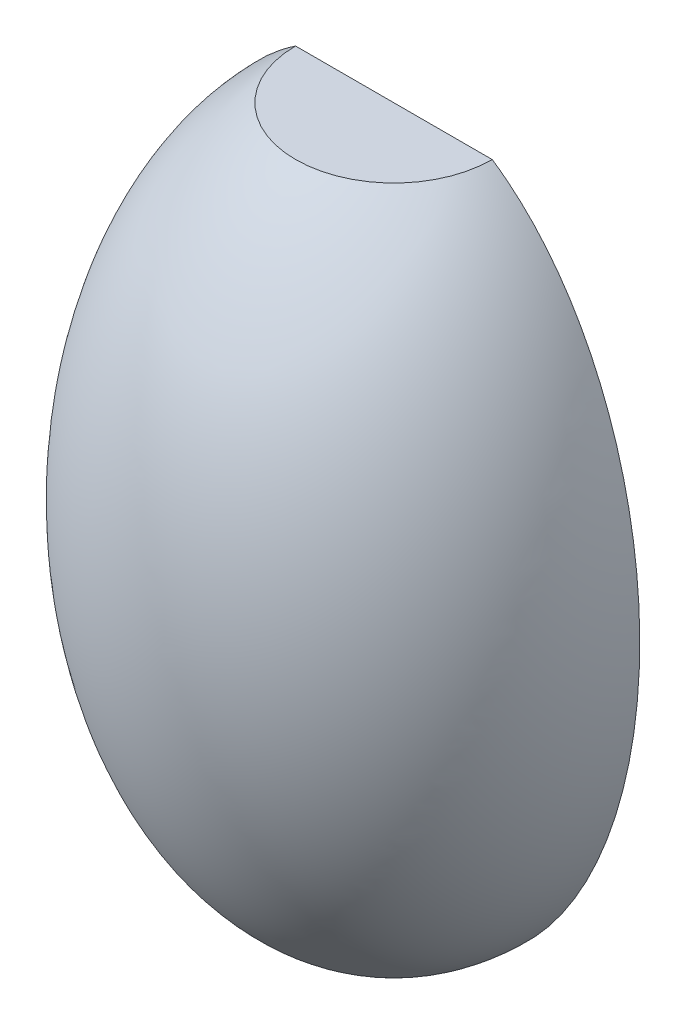
from build123d import *

# Parameters (mm, degrees)
VACIADO1_T              = -2
CROQUIS2_R              = 10
SALIENTE_EXTRUIR1_DEPTH = 2
CROQUIS3_R              = 10
SALIENTE_EXTRUIR2_DEPTH = 2
CROQUIS4_W              = 80.821615775
CROQUIS4_H              = 80
CORTAR_EXTRUIR1_DEPTH   = 50


with BuildPart() as part:
    # Croquis1 → Revolución1 (revolve)
    with BuildSketch(Plane.XY):
        with BuildLine():
            Line((0, 35), (10, 35))
            add(Edge.make_bspline(
                [(10, -35), (62.5, 0), (10, 35)],
                knots=[3.5531095, 3.5531095, 3.5531095, 5.871668461, 5.871668461, 5.871668461], degree=2, weights=[1, 0.4, 1]))
            Line((10, -35), (0, -35))
            Line((0, -35), (0, 0))
            Line((0, 0), (0, 35))
        make_face()
    revolve(axis=Axis((0, 0, 0), (0, 1, 0)))

    # Vaciado1
    vaciado1_openings = [part.faces().sort_by_distance(p)[0] for p in [
        (0, 35, 0),
        (0, -35, 0),
    ]]
    offset(amount=VACIADO1_T, openings=vaciado1_openings)

    # Croquis2 → Saliente-Extruir1 (add)
    with BuildSketch(Plane(origin=(0, 35, 0), x_dir=(1, 0, 0), z_dir=(0, 1, 0))):
        Circle(CROQUIS2_R)
    extrude(amount=-SALIENTE_EXTRUIR1_DEPTH)

    # Croquis3 → Saliente-Extruir2 (add)
    with BuildSketch(Plane.XZ.offset(35)):
        Circle(CROQUIS3_R)
    extrude(amount=-SALIENTE_EXTRUIR2_DEPTH)

    # Croquis4 → Cortar-Extruir1 (cut)
    with BuildSketch(Plane.XY):
        with Locations((2.983348233, -0.749824732)):
            Rectangle(CROQUIS4_W, CROQUIS4_H)
    extrude(amount=-CORTAR_EXTRUIR1_DEPTH, mode=Mode.SUBTRACT)


solid = part.part
